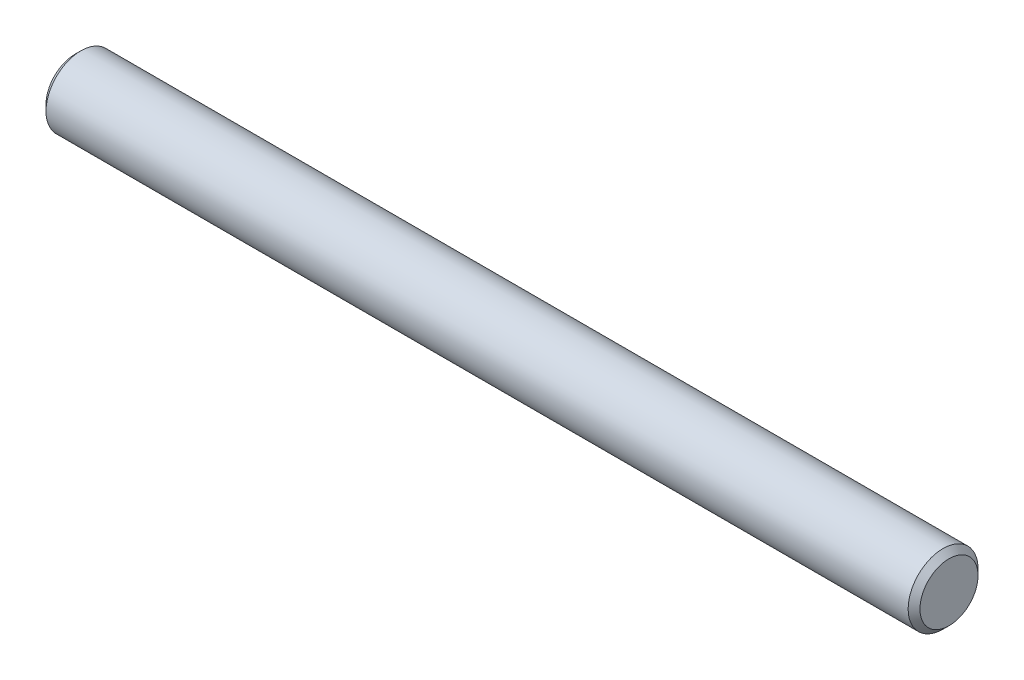
from build123d import *


with BuildPart() as part:
    # 草图1 → 旋转1 (revolve)
    with BuildSketch(Plane.XY, mode=Mode.PRIVATE) as revolve_1_sk:
        Polygon((-50, 0), (-50, 3.3235), (-49.3235, 4), (49.3235, 4), (50, 3.3235), (50, 0), align=None)
    revolve(revolve_1_sk.sketch.rotate(Axis((50, 0, 0), (-1, 0, 0)), 270), axis=Axis((50, 0, 0), (-1, 0, 0)))


solid = part.part
